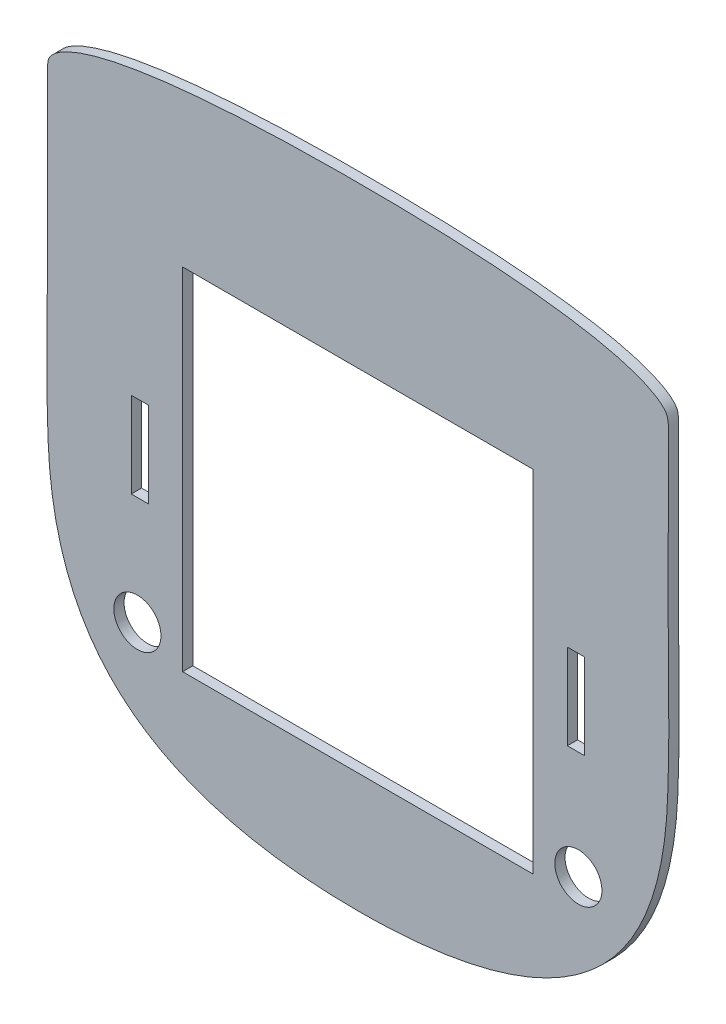
from build123d import *

# Parameters (mm, degrees)
SKETCH2_R           = 7
SKETCH2_W           = 5.08
SKETCH2_H           = 25.4
BOSS_EXTRUDE1_DEPTH = 3.048
CUT_EXTRUDE1_DEPTH  = 41.402


with BuildPart() as part:
    # Sketch2 → Boss-Extrude1 (new body)
    with BuildSketch(Plane(origin=(-0.201743714, -72.235465767, -2871.297081617), x_dir=(1, 0, 0), z_dir=(0, 0, 1))):
        with BuildLine():
            add(Edge.make_bspline(
                [(98.004062475, 101.157461169), (98.09262319, 100.582578169), (98.168282436, 99.850726468), (98.201035971, 98.964297447), (98.205576946, 98.520375047), (98.203312676, 98.076151585), (98.2036357, 97.631790351), (98.202558859, 97.187198741), (98.201774618, 96.594166212), (98.199727801, 95.555659629), (98.196350571, 94.070122586), (98.191219577, 92.28435558), (98.185300348, 90.49549016), (98.178622098, 88.703544032), (98.171344138, 86.908538509), (98.163557432, 85.110493402), (98.155396592, 83.309431675), (98.146977163, 81.505376018), (98.135573428, 79.096007637), (98.121287428, 76.076928858), (98.105071958, 72.442435741), (98.090760178, 68.796539176), (98.079583302, 65.139438492), (98.072772264, 61.471337421), (98.071088324, 57.79245144), (98.075293125, 54.103000287), (98.087402852, 50.403265868), (98.10943536, 46.693533793), (98.149097734, 41.734317266), (98.212450561, 35.511894369), (98.259787617, 28.010008132), (98.250221769, 21.731245729), (98.193919112, 16.694316231), (98.134491312, 13.540940962), (98.069931219, 11.015367159), (98.012479287, 9.119948631), (97.944993251, 7.223485327), (97.867530353, 5.326182094), (97.778046924, 3.42822235), (97.678623521, 1.529831063), (97.562359374, -0.368849117), (97.273887049, -4.165889382), (96.636661612, -9.85760728), (95.264266353, -17.392207333), (93.283204663, -24.816906824), (90.614186019, -32.040137569), (87.187668119, -38.958467556), (83.676565473, -44.359852554), (80.486245723, -48.402543782), (77.054491026, -52.240907458), (72.331970353, -56.62733417), (66.103033739, -61.188185381), (59.428677872, -65.046681648), (52.43241755, -68.244481021), (45.195675565, -70.83196856), (37.797306155, -72.863270501), (30.289713623, -74.393153681), (22.727531896, -75.494270646), (12.612681112, -76.462699086), (5.032383013, -76.714841356), (-5.035467708, -76.714845104), (-12.619786852, -76.462418803), (-22.738781506, -75.493068818), (-30.303459175, -74.391002905), (-37.812929796, -72.859918013), (-45.212549357, -70.8271864), (-52.449882097, -68.238039152), (-59.446050161, -65.038426839), (-66.11960737, -61.178042376), (-72.347079086, -56.615416709), (-77.067892297, -52.227754271), (-80.498089265, -48.388656373), (-83.686768813, -44.345422026), (-87.195743233, -38.943757554), (-90.61986046, -32.025747475), (-93.286817212, -24.803397784), (-95.266250936, -17.379993897), (-96.637448669, -9.846957631), (-97.274071314, -4.156518411), (-97.562243264, -0.360344948), (-97.678371151, 1.537899747), (-97.777873142, 3.435856699), (-97.867367387, 5.333384926), (-97.944866703, 7.230259477), (-98.01237118, 9.126297729), (-98.069845849, 11.021295221), (-98.134428193, 13.546313761), (-98.193879205, 16.699007643), (-98.250205894, 21.73487995), (-98.259784562, 28.01239372), (-98.21244762, 35.512930688), (-98.149088971, 41.734380411), (-98.109425083, 46.69292327), (-98.087392785, 50.402205893), (-98.075284257, 54.10154993), (-98.071081296, 57.790672769), (-98.072767321, 61.469295328), (-98.079580473, 65.137200586), (-98.090759277, 68.794175587), (-98.10507262, 72.440018947), (-98.121289158, 76.074533479), (-98.135575612, 79.093693997), (-98.146979553, 81.503167019), (-98.155398915, 83.307320997), (-98.163559853, 85.108501066), (-98.171346036, 86.906684767), (-98.178624384, 88.70184922), (-98.185301078, 90.493974969), (-98.19122227, 92.28304054), (-98.196348387, 94.069029013), (-98.19973362, 95.554767419), (-98.201767603, 96.593425349), (-98.202574021, 97.186545216), (-98.203601448, 97.631207844), (-98.203365989, 98.075631059), (-98.205614022, 98.519942912), (-98.200956032, 98.963909964), (-98.168457073, 99.850519984), (-98.092668955, 100.58248079), (-97.911826163, 101.756705998), (-97.591091313, 102.927189457), (-96.744501402, 104.523718023), (-95.628370708, 105.930697933), (-94.324169919, 107.14983424), (-92.908919976, 108.210412348), (-90.919547633, 109.448243636), (-88.32196599, 110.731146164), (-85.128922247, 111.980994275), (-81.907009003, 113.019085815), (-78.679652448, 113.899326262), (-75.458556986, 114.656106392), (-72.248323156, 115.314989419), (-69.051267541, 115.893006101), (-65.867703019, 116.403620435), (-62.697382089, 116.855995394), (-59.54006886, 117.258606965), (-55.346025805, 117.736366707), (-50.130480964, 118.237811214), (-43.904887694, 118.718293109), (-37.698280921, 119.100136152), (-31.497185994, 119.401363035), (-25.286074462, 119.631882757), (-19.049652571, 119.802550798), (-10.6782592, 119.95730558), (-4.311359032, 120), (4.311566967, 120), (10.678373272, 119.957301971), (19.049194344, 119.802559271), (25.285019509, 119.631912925), (31.495423882, 119.401431783), (37.695748902, 119.100264796), (43.901569172, 118.718504865), (50.126405995, 118.238134551), (55.341386835, 117.736807508), (59.535046852, 117.259158056), (62.692115597, 116.856637797), (65.862243647, 116.404363117), (69.04567768, 115.893856369), (72.242677523, 115.315956677), (75.452943985, 114.657195729), (78.674177119, 113.900542139), (81.901794523, 113.020426463), (85.124114848, 111.98245115), (88.317738818, 110.73269729), (90.915977188, 109.449832), (92.905995487, 108.211972862), (94.321790196, 107.151328604), (95.626592976, 105.93205679), (96.74337158, 104.52484085), (97.59061533, 102.927904772), (97.911707231, 101.756975983), (98.004062475, 101.157461169)],
                knots=[0, 0, 0, 0, 0.00256774, 0.003209675, 0.00385161, 0.004493545, 0.00513548, 0.005777415, 0.00641935, 0.00770322, 0.010270959, 0.012838699, 0.015406439, 0.017974179, 0.020541919, 0.023109659, 0.025677399, 0.028245138, 0.030812878, 0.035948358, 0.041083838, 0.046219318, 0.051354797, 0.056490277, 0.061625757, 0.066761236, 0.071896716, 0.077032196, 0.082167676, 0.092438635, 0.102709594, 0.112980554, 0.118116034, 0.123251513, 0.125819253, 0.128386993, 0.130954733, 0.133522473, 0.136090213, 0.138657953, 0.141225692, 0.143793432, 0.154064392, 0.164335351, 0.174606311, 0.18487727, 0.19514823, 0.205419189, 0.210554669, 0.215690148, 0.225961108, 0.236232067, 0.246503027, 0.256773986, 0.267044946, 0.277315905, 0.287586865, 0.297857824, 0.308128783, 0.328670702, 0.328670702, 0.349206929, 0.359475043, 0.369743156, 0.38001127, 0.390279383, 0.400547497, 0.41081561, 0.421083724, 0.431351837, 0.441619951, 0.446754008, 0.451888064, 0.462156178, 0.472424291, 0.482692405, 0.492960518, 0.503228632, 0.513496745, 0.516063774, 0.518630802, 0.521197831, 0.523764859, 0.526331887, 0.528898916, 0.531465944, 0.534032972, 0.539167029, 0.544301086, 0.554569199, 0.564837313, 0.575105426, 0.580239483, 0.58537354, 0.590507597, 0.595641653, 0.60077571, 0.605909767, 0.611043824, 0.61617788, 0.621311937, 0.626445994, 0.629013022, 0.631580051, 0.634147079, 0.636714107, 0.639281136, 0.641848164, 0.644415193, 0.646982221, 0.649549249, 0.650832764, 0.651474521, 0.652116278, 0.652758035, 0.653399792, 0.654041549, 0.654683306, 0.657250335, 0.657250335, 0.659928039, 0.662605744, 0.665283448, 0.667961153, 0.670638857, 0.673316562, 0.678671971, 0.68402738, 0.68938279, 0.694738199, 0.700093608, 0.705449017, 0.710804426, 0.716159836, 0.721515245, 0.726870654, 0.732226063, 0.742936882, 0.7536477, 0.764358518, 0.775069337, 0.785780155, 0.796490973, 0.807201792, 0.828623429, 0.828623429, 0.8500455, 0.860756536, 0.871467571, 0.882178607, 0.892889643, 0.903600679, 0.914311714, 0.92502275, 0.930378268, 0.935733786, 0.941089304, 0.946444821, 0.951800339, 0.957155857, 0.962511375, 0.967866893, 0.973222411, 0.978577929, 0.983933446, 0.986611205, 0.989288964, 0.991966723, 0.994644482, 0.997322241, 1, 1, 1, 1], degree=3))
        make_face()
        with Locations(Location((65.5, -30.887752409, 0), (0, 0, 180))):
            Circle(SKETCH2_R, mode=Mode.SUBTRACT)
        with Locations(Location((-65.5, -30.887752409, 0), (0, 0, 180))):
            Circle(SKETCH2_R, mode=Mode.SUBTRACT)
        Polygon((52.07, 67.252248214), (-52.07000195, 67.252248214), (-52.07000195, -36.887752409), (52.070001625, -36.887752409), align=None, mode=Mode.SUBTRACT)
        with Locations((-64.77000195, 13.912248214)):
            Rectangle(SKETCH2_W, SKETCH2_H, mode=Mode.SUBTRACT)
        with Locations((64.77, 13.912248214)):
            Rectangle(SKETCH2_W, SKETCH2_H, mode=Mode.SUBTRACT)
    extrude(amount=BOSS_EXTRUDE1_DEPTH)

    # Sketch8 → Cut-Extrude1 (cut)
    with BuildSketch(Plane(origin=(0, 0, -2871.297081617), x_dir=(-1, 0, 0), z_dir=(0, 0, -1))):
        with BuildLine():
            add(Edge.make_bspline(
                [(-97.802318762, 28.921995402), (-97.890879476, 28.347112402), (-97.966538722, 27.615260701), (-97.999292258, 26.72883168), (-98.003833232, 26.28490928), (-98.001568962, 25.840685818), (-98.001891986, 25.396324584), (-98.000815145, 24.951732974), (-98.000030904, 24.358700446), (-97.997984087, 23.320193862), (-97.994606857, 21.834656819), (-97.989475863, 20.048889814), (-97.983556634, 18.260024394), (-97.976878385, 16.468078265), (-97.969600424, 14.673072742), (-97.961813718, 12.875027636), (-97.953652879, 11.073965908), (-97.945233449, 9.269910252), (-97.933829714, 6.860541871), (-97.919543714, 3.841463091), (-97.903328244, 0.206969974), (-97.889016464, -3.438926591), (-97.877839588, -7.096027275), (-97.87102855, -10.764128346), (-97.86934461, -14.443014327), (-97.873549411, -18.13246548), (-97.885659138, -21.832199899), (-97.907691646, -25.541931973), (-97.947354021, -30.501148501), (-98.010706847, -36.723571398), (-98.058043903, -44.225457635), (-98.048478055, -50.504220038), (-97.992175398, -55.541149536), (-97.932747598, -58.694524805), (-97.868187505, -61.220098607), (-97.810735573, -63.115517135), (-97.743249537, -65.01198044), (-97.665786639, -66.909283673), (-97.57630321, -68.807243416), (-97.476879807, -70.705634704), (-97.36061566, -72.604314884), (-97.072143335, -76.401355149), (-96.434917898, -82.093073046), (-95.062522639, -89.6276731), (-93.08146095, -97.052372591), (-90.412442305, -104.275603335), (-86.985924405, -111.193933323), (-83.474821759, -116.595318321), (-80.284502009, -120.638009549), (-76.852747312, -124.476373225), (-72.130226639, -128.862799937), (-65.901290026, -133.423651148), (-59.226934158, -137.282147414), (-52.230673836, -140.479946788), (-44.993931851, -143.067434327), (-37.595562441, -145.098736268), (-30.087969909, -146.628619448), (-22.525788182, -147.729736413), (-12.410937398, -148.698164853), (-4.830639299, -148.950307123), (5.237211422, -148.950310871), (12.821530566, -148.697884569), (22.94052522, -147.728534585), (30.505202888, -146.626468672), (38.01467351, -145.09538378), (45.414293071, -143.062652167), (52.651625811, -140.473504918), (59.647793875, -137.273892606), (66.321351084, -133.413508142), (72.5488228, -128.850882476), (77.269636011, -124.463220038), (80.699832979, -120.624122139), (83.888512527, -116.580887793), (87.397486947, -111.17922332), (90.821604174, -104.261213242), (93.488560926, -97.038863551), (95.46799465, -89.615459663), (96.839192383, -82.082423398), (97.475815028, -76.391984177), (97.763986978, -72.595810715), (97.880114865, -70.69756602), (97.979616856, -68.799609067), (98.069111101, -66.902080841), (98.146610416, -65.00520629), (98.214114894, -63.109168038), (98.271589563, -61.214170545), (98.336171907, -58.689152006), (98.395622919, -55.536458124), (98.451949608, -50.500585817), (98.461528276, -44.223072047), (98.414191334, -36.722535078), (98.350832684, -30.501085356), (98.311168797, -25.542542497), (98.289136499, -21.833259874), (98.277027971, -18.133915836), (98.27282501, -14.444792997), (98.274511034, -10.766170439), (98.281324187, -7.09826518), (98.292502991, -3.44129018), (98.306816334, 0.20455318), (98.323032872, 3.839067712), (98.337319326, 6.85822823), (98.348723267, 9.267701252), (98.357142629, 11.07185523), (98.365303567, 12.873035299), (98.37308975, 14.671219), (98.380368097, 16.466383454), (98.387044792, 18.258509202), (98.392965984, 20.047574773), (98.398092101, 21.833563247), (98.401477334, 23.319301652), (98.403511317, 24.357959583), (98.404317734, 24.951079449), (98.405345162, 25.395742077), (98.405109703, 25.840165292), (98.407357735, 26.284477146), (98.402699746, 26.728444197), (98.370200787, 27.615054217), (98.294412669, 28.347015023), (98.113569876, 29.521240231), (97.792835026, 30.69172369), (96.946245115, 32.288252256), (95.830114422, 33.695232166), (94.525913633, 34.914368473), (93.11066369, 35.974946581), (91.121291347, 37.21277787), (88.523709704, 38.495680397), (85.330665961, 39.745528508), (82.108752716, 40.783620049), (78.881396161, 41.663860496), (75.6603007, 42.420640625), (72.45006687, 43.079523652), (69.253011254, 43.657540334), (66.069446732, 44.168154669), (62.899125803, 44.620529627), (59.741812573, 45.023141198), (55.547769519, 45.50090094), (50.332224678, 46.002345447), (44.106631408, 46.482827342), (37.900024635, 46.864670385), (31.698929708, 47.165897269), (25.487818176, 47.39641699), (19.251396285, 47.567085031), (10.880002913, 47.721839814), (4.513102746, 47.764534233), (-4.109823253, 47.764534233), (-10.476629559, 47.721836204), (-18.84745063, 47.567093504), (-25.083275795, 47.396447158), (-31.293680168, 47.165966016), (-37.494005188, 46.864799029), (-43.699825458, 46.483039098), (-49.924662281, 46.002668784), (-55.139643121, 45.501341742), (-59.333303138, 45.02369229), (-62.490371883, 44.62117203), (-65.660499933, 44.16889735), (-68.843933966, 43.658390602), (-72.040933809, 43.08049091), (-75.251200271, 42.421729962), (-78.472433405, 41.665076372), (-81.700050809, 40.784960696), (-84.922371134, 39.746985383), (-88.115995104, 38.497231523), (-90.714233474, 37.214366233), (-92.704251774, 35.976507095), (-94.120046482, 34.915862837), (-95.424849262, 33.696591023), (-96.541627866, 32.289375083), (-97.388871616, 30.692439005), (-97.709963517, 29.521510216), (-97.802318762, 28.921995402)],
                knots=[0, 0, 0, 0, 0.00256774, 0.003209675, 0.00385161, 0.004493545, 0.00513548, 0.005777415, 0.00641935, 0.00770322, 0.010270959, 0.012838699, 0.015406439, 0.017974179, 0.020541919, 0.023109659, 0.025677399, 0.028245138, 0.030812878, 0.035948358, 0.041083838, 0.046219318, 0.051354797, 0.056490277, 0.061625757, 0.066761236, 0.071896716, 0.077032196, 0.082167676, 0.092438635, 0.102709594, 0.112980554, 0.118116034, 0.123251513, 0.125819253, 0.128386993, 0.130954733, 0.133522473, 0.136090213, 0.138657953, 0.141225692, 0.143793432, 0.154064392, 0.164335351, 0.174606311, 0.18487727, 0.19514823, 0.205419189, 0.210554669, 0.215690148, 0.225961108, 0.236232067, 0.246503027, 0.256773986, 0.267044946, 0.277315905, 0.287586865, 0.297857824, 0.308128783, 0.328670702, 0.328670702, 0.349206929, 0.359475043, 0.369743156, 0.38001127, 0.390279383, 0.400547497, 0.41081561, 0.421083724, 0.431351837, 0.441619951, 0.446754008, 0.451888064, 0.462156178, 0.472424291, 0.482692405, 0.492960518, 0.503228632, 0.513496745, 0.516063774, 0.518630802, 0.521197831, 0.523764859, 0.526331887, 0.528898916, 0.531465944, 0.534032972, 0.539167029, 0.544301086, 0.554569199, 0.564837313, 0.575105426, 0.580239483, 0.58537354, 0.590507597, 0.595641653, 0.60077571, 0.605909767, 0.611043824, 0.61617788, 0.621311937, 0.626445994, 0.629013022, 0.631580051, 0.634147079, 0.636714107, 0.639281136, 0.641848164, 0.644415193, 0.646982221, 0.649549249, 0.650832764, 0.651474521, 0.652116278, 0.652758035, 0.653399792, 0.654041549, 0.654683306, 0.657250335, 0.657250335, 0.659928039, 0.662605744, 0.665283448, 0.667961153, 0.670638857, 0.673316562, 0.678671971, 0.68402738, 0.68938279, 0.694738199, 0.700093608, 0.705449017, 0.710804426, 0.716159836, 0.721515245, 0.726870654, 0.732226063, 0.742936882, 0.7536477, 0.764358518, 0.775069337, 0.785780155, 0.796490973, 0.807201792, 0.828623429, 0.828623429, 0.8500455, 0.860756536, 0.871467571, 0.882178607, 0.892889643, 0.903600679, 0.914311714, 0.92502275, 0.930378268, 0.935733786, 0.941089304, 0.946444821, 0.951800339, 0.957155857, 0.962511375, 0.967866893, 0.973222411, 0.978577929, 0.983933446, 0.986611205, 0.989288964, 0.991966723, 0.994644482, 0.997322241, 1, 1, 1, 1], degree=3))
        make_face()
        with BuildLine():
            add(Edge.make_bspline(
                [(0.201743522, -144.623319731), (-3.274536304, -144.623319865), (-6.738547743, -144.537415239), (-13.639117858, -144.17337837), (-17.075885232, -143.896707457), (-23.917176856, -143.117595306), (-27.321713607, -142.615241598), (-34.091569015, -141.335924274), (-37.456790771, -140.558282134), (-42.467583889, -139.132463684), (-44.131958582, -138.613639953), (-47.445143032, -137.476320327), (-49.079136574, -136.862852677), (-53.907042783, -134.875577699), (-57.027450589, -133.356027639), (-61.530249164, -130.724141208), (-63.001395544, -129.787786199), (-65.157935979, -128.283760343), (-65.868579212, -127.765607018), (-67.258794227, -126.705614731), (-67.940144477, -126.162576337), (-71.27754047, -123.381633721), (-73.725197711, -120.946171591), (-77.049028104, -116.96339166), (-78.099695644, -115.581499232), (-79.589134787, -113.426597328), (-80.072068485, -112.693245508), (-81.004897857, -111.205414168), (-81.453226985, -110.453556275), (-83.607344907, -106.655829248), (-85.05323229, -103.495825112), (-86.875348272, -98.603559912), (-87.424591436, -96.947277726), (-88.168216421, -94.427617375), (-88.402634024, -93.581952361), (-88.843052793, -91.891169187), (-89.049511593, -91.044543362), (-90.017851718, -86.805673806), (-90.589625027, -83.396366179), (-91.214815991, -78.261538564), (-91.3840958, -76.546418242), (-91.654496844, -73.110059757), (-91.754016272, -71.388677816), (-91.898041054, -67.94097593), (-91.953937652, -66.21567845), (-92.047124571, -62.763413411), (-92.082532425, -61.036276883), (-92.216452156, -52.396723879), (-92.18174868, -45.471992609), (-92.088776017, -35.090783444), (-92.050582828, -31.630433758), (-91.989104785, -24.709623916), (-91.967343228, -21.249135437), (-91.935387884, -10.86768894), (-91.950845684, -3.946701754), (-91.989167962, 6.434762218), (-92.005223842, 9.895238506), (-92.030335068, 16.816216046), (-92.042022057, 20.276707913), (-92.052491789, 24.169770815), (-92.053737389, 24.602325411), (-92.055319228, 25.251182986), (-92.056417151, 25.467506003), (-92.057189797, 25.900059362), (-92.057095442, 26.116304741), (-92.02698149, 26.763098356), (-91.978779879, 27.19246262), (-91.889344649, 27.727267604), (-91.870064381, 27.83414662), (-91.828925375, 28.047701464), (-91.808160197, 28.154405584), (-91.726988406, 28.467446667), (-91.65227417, 28.66842382), (-91.468917245, 29.057668114), (-91.359394128, 29.247447264), (-91.11804123, 29.606368595), (-90.986480026, 29.776462145), (-90.568248072, 30.266477752), (-90.256757384, 30.567894605), (-89.601419654, 31.129549974), (-89.259792729, 31.387452268), (-88.557956958, 31.872737011), (-88.197767155, 32.100150737), (-87.096730457, 32.748775452), (-86.335064825, 33.135792743), (-84.777268278, 33.853219879), (-83.986925551, 34.179530259), (-81.601253499, 35.088514112), (-79.986643693, 35.603747797), (-76.729369531, 36.528837706), (-75.086341974, 36.937329685), (-71.780252186, 37.679060145), (-70.117182339, 38.012270017), (-66.776153116, 38.622762265), (-65.097074445, 38.899741463), (-61.737301209, 39.407885048), (-60.055411866, 39.639429545), (-55.004811485, 40.27858234), (-51.631273297, 40.631893297), (-44.8751476, 41.236725519), (-41.492474378, 41.487282667), (-31.334002379, 42.121382869), (-24.544052969, 42.389307732), (-10.974643961, 42.717803017), (-4.192330738, 42.777909329), (9.368637658, 42.738812197), (16.147215028, 42.636220411), (29.699167251, 42.204464881), (36.472601324, 41.877880212), (46.62672232, 41.125389049), (50.010405342, 40.829964018), (56.775001058, 40.118464923), (60.149502258, 39.703179825), (66.874429576, 38.697267592), (70.226685679, 38.108245128), (75.205795664, 37.005329061), (76.859061013, 36.599674154), (80.133291379, 35.682509559), (81.75724986, 35.171544533), (84.146014914, 34.277014131), (84.933113097, 33.957970061), (86.481394857, 33.260825802), (87.244594757, 32.883160796), (88.72406713, 32.039193106), (89.437776152, 31.578598492), (90.431586847, 30.773845288), (90.748830719, 30.486610048), (91.184220302, 30.020992011), (91.322848846, 29.859654122), (91.582701428, 29.520562866), (91.703496358, 29.342864518), (91.914884307, 28.975434703), (92.006759063, 28.784977768), (92.118252687, 28.486452265), (92.151015114, 28.38479609), (92.206584763, 28.17662686), (92.227506651, 28.071891945), (92.329344448, 27.548669314), (92.39159565, 27.128973088), (92.443543455, 26.497018498), (92.45523748, 26.286039897), (92.462017015, 25.863116448), (92.460346666, 25.651360338), (92.458083199, 25.016251853), (92.457289977, 24.592887837), (92.45093913, 22.475929022), (92.445997129, 20.782404301), (92.429509702, 15.701769956), (92.417556107, 12.314683849), (92.389510302, 5.540526499), (92.375801061, 2.153443402), (92.345673384, -8.00778177), (92.340360666, -14.781904332), (92.393318139, -24.942974536), (92.423417891, -28.32997472), (92.490213033, -35.103962787), (92.525899349, -38.491049624), (92.599380118, -48.650942063), (92.605139835, -55.422441517), (92.423350701, -63.879111689), (92.37698766, -65.57003786), (92.261788465, -68.950974084), (92.19632998, -70.641121827), (91.893906299, -75.707241991), (91.568112557, -79.079593307), (90.837153692, -84.128244194), (90.552935949, -85.809474195), (89.891323681, -89.168135838), (89.515906538, -90.834550134), (88.244354253, -95.779057782), (87.202473146, -99.007446467), (85.285940995, -103.726254701), (84.587996215, -105.278509513), (83.44261575, -107.572436225), (83.043626428, -108.332733268), (82.214469653, -109.834639411), (81.785650062, -110.57381334), (79.570074017, -114.210562237), (77.570688207, -116.932267832), (74.224079389, -120.727378139), (73.04987121, -121.943886373), (71.201237497, -123.696423665), (70.570511353, -124.268597235), (69.280049641, -125.388950185), (68.618635142, -125.938410226), (65.262197027, -128.607702982), (62.426605155, -130.48902916), (57.983597367, -132.990734487), (56.471068344, -133.771385502), (54.158695701, -134.868753278), (53.380631714, -135.222257654), (51.810471978, -135.905565591), (51.018390834, -136.23530376), (47.049358743, -137.817468481), (43.826477644, -138.880572429), (37.306563581, -140.691491332), (34.009381997, -141.438674363), (27.353837442, -142.672901073), (23.995657139, -143.16072145), (18.919984401, -143.729167953), (17.220737046, -143.891322706), (13.822843435, -144.164632358), (12.122727142, -144.276152944), (8.720321786, -144.452497738), (7.018028553, -144.517232289), (4.463051204, -144.581290722), (3.185178094, -144.605057776), (1.693674208, -144.618775071), (0.94776185, -144.622186153), (0.628051025, -144.622915154), (0.414902926, -144.62323894), (0.310377266, -144.623319727), (0.201743522, -144.623319731)],
                knots=[0, 0, 0, 0, 0.015625, 0.015625, 0.03125, 0.03125, 0.046875, 0.046875, 0.0625, 0.0625, 0.0703125, 0.0703125, 0.078125, 0.078125, 0.09375, 0.09375, 0.1015625, 0.1015625, 0.10546875, 0.10546875, 0.109375, 0.109375, 0.125, 0.125, 0.1328125, 0.1328125, 0.13671875, 0.13671875, 0.140625, 0.140625, 0.15625, 0.15625, 0.1640625, 0.1640625, 0.16796875, 0.16796875, 0.171875, 0.171875, 0.1875, 0.1875, 0.1953125, 0.1953125, 0.203125, 0.203125, 0.2109375, 0.2109375, 0.21875, 0.21875, 0.25, 0.25, 0.265625, 0.265625, 0.28125, 0.28125, 0.3125, 0.3125, 0.328125, 0.328125, 0.34375, 0.34375, 0.345703125, 0.345703125, 0.346679688, 0.346679688, 0.34765625, 0.34765625, 0.349609375, 0.349609375, 0.350097656, 0.350097656, 0.350585938, 0.350585938, 0.3515625, 0.3515625, 0.352539062, 0.352539062, 0.353515625, 0.353515625, 0.35546875, 0.35546875, 0.357421875, 0.357421875, 0.359375, 0.359375, 0.36328125, 0.36328125, 0.3671875, 0.3671875, 0.375, 0.375, 0.3828125, 0.3828125, 0.390625, 0.390625, 0.3984375, 0.3984375, 0.40625, 0.40625, 0.421875, 0.421875, 0.4375, 0.4375, 0.46875, 0.46875, 0.5, 0.5, 0.53125, 0.53125, 0.5625, 0.5625, 0.578125, 0.578125, 0.59375, 0.59375, 0.609375, 0.609375, 0.6171875, 0.6171875, 0.625, 0.625, 0.62890625, 0.62890625, 0.6328125, 0.6328125, 0.63671875, 0.63671875, 0.638671875, 0.638671875, 0.639648437, 0.639648437, 0.640625, 0.640625, 0.641601562, 0.641601562, 0.642089844, 0.642089844, 0.642578125, 0.642578125, 0.64453125, 0.64453125, 0.645507812, 0.645507812, 0.646484375, 0.646484375, 0.6484375, 0.6484375, 0.65625, 0.65625, 0.671875, 0.671875, 0.6875, 0.6875, 0.71875, 0.71875, 0.734375, 0.734375, 0.75, 0.75, 0.78125, 0.78125, 0.7890625, 0.7890625, 0.796875, 0.796875, 0.8125, 0.8125, 0.8203125, 0.8203125, 0.828125, 0.828125, 0.84375, 0.84375, 0.8515625, 0.8515625, 0.85546875, 0.85546875, 0.859375, 0.859375, 0.875, 0.875, 0.8828125, 0.8828125, 0.88671875, 0.88671875, 0.890625, 0.890625, 0.90625, 0.90625, 0.9140625, 0.9140625, 0.91796875, 0.91796875, 0.921875, 0.921875, 0.9375, 0.9375, 0.953125, 0.953125, 0.96875, 0.96875, 0.9765625, 0.9765625, 0.984375, 0.984375, 0.9921875, 0.9921875, 0.99609375, 0.998046875, 0.999023438, 0.999511719, 0.999511719, 1, 1, 1, 1], degree=3))
        make_face(mode=Mode.SUBTRACT)
    extrude(amount=-CUT_EXTRUDE1_DEPTH, mode=Mode.SUBTRACT)


solid = part.part
